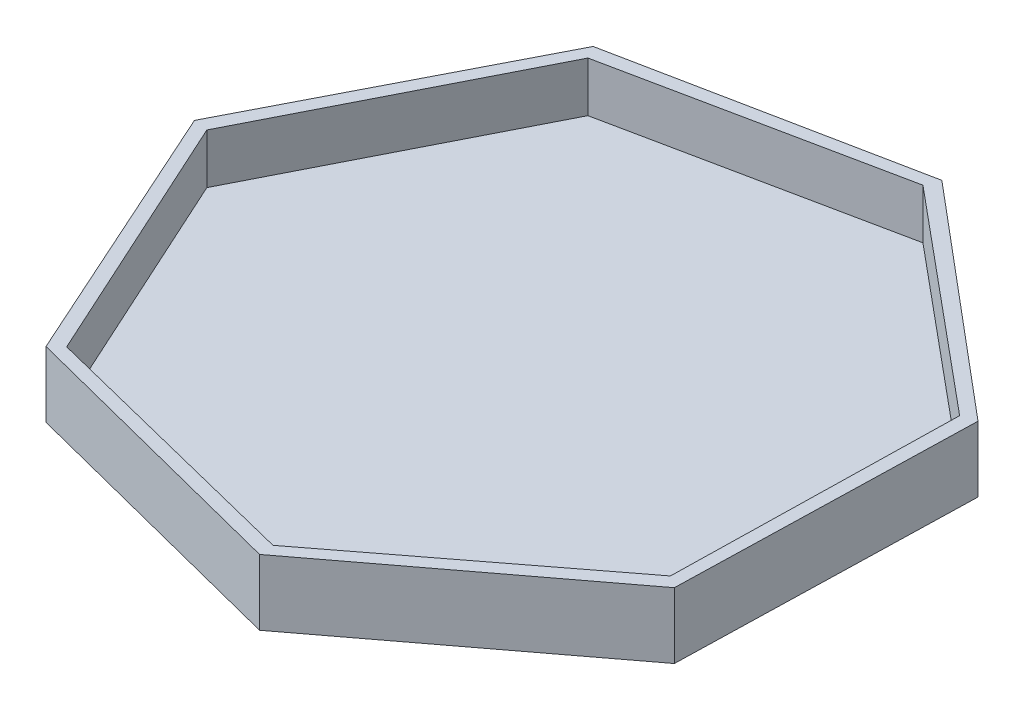
from build123d import *

# Parameters (mm, degrees)
BOSS_EXTRUDE1_DEPTH = 5
CUT_EXTRUDE1_DEPTH  = 3.8


with BuildPart() as part:
    # Sketch1 → Boss-Extrude1 (new body)
    with BuildSketch(Plane(origin=(0, 0, 0), x_dir=(1, 0, 0), z_dir=(0, 1, 0))):
        Polygon((-16.711679863, -19.881566597), (5.12447272, -25.46167146), (23.101792825, -11.86861839), (23.682991741, 10.661746403), (6.430414832, 25.163598695), (-15.664395602, 20.716747925), (-25.963596653, 0.669763423), align=None)
    extrude(amount=BOSS_EXTRUDE1_DEPTH)

    # Sketch5 → Cut-Extrude1 (cut)
    with BuildSketch(Plane(origin=(0, 5, 0), x_dir=(1, 0, 0), z_dir=(0, 1, 0))):
        Polygon((6.029700068, 24.123724456), (-15.101230753, 19.755105525), (-24.860626809, 0.510489202), (-15.899463813, -19.118535902), (5.034319724, -24.350913524), (22.177157828, -11.246556595), (22.620143755, 10.326686838), align=None)
    extrude(amount=-CUT_EXTRUDE1_DEPTH, mode=Mode.SUBTRACT)


solid = part.part
